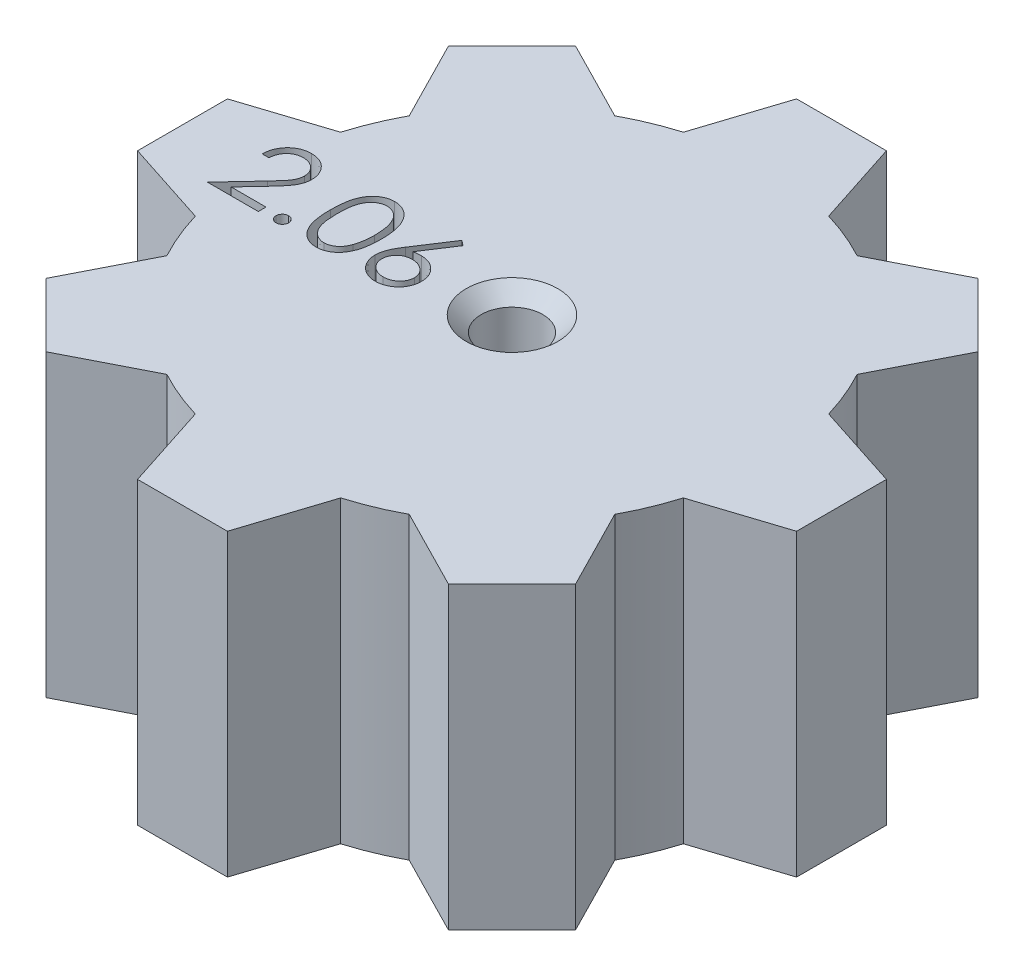
from build123d import *

# Parameters (mm, degrees)
SKETCH1_R           = 1.03
BOSS_EXTRUDE1_DEPTH = 10
CUT_EXTRUDE1_DEPTH  = 1
CHAMFER1_SIZE       = 0.5


with BuildPart() as part:
    # Sketch1 → Boss-Extrude1 (new body)
    with BuildSketch(Plane(origin=(0, 0, 0), x_dir=(1, 0, 0), z_dir=(0, 1, 0))):
        with BuildLine():
            Line((-1.5, 11), (1.5, 11))
            Line((1.5, 11), (2.425924848, 8.146464793))
            ThreePointArc((2.425924848, 8.146464793), (3.252809175, 7.852976026), (4.045032587, 7.475808409))
            Line((4.045032587, 7.475808409), (6.717514421, 8.838834765))
            Line((6.717514421, 8.838834765), (8.838834765, 6.717514421))
            Line((8.838834765, 6.717514421), (7.475808409, 4.045032587))
            ThreePointArc((7.475808409, 4.045032587), (7.852976026, 3.252809175), (8.146464793, 2.425924848))
            Line((8.146464793, 2.425924848), (11, 1.5))
            Line((11, 1.5), (11, -1.5))
            Line((11, -1.5), (8.146464793, -2.425924848))
            ThreePointArc((8.146464793, -2.425924848), (7.852976026, -3.252809175), (7.475808409, -4.045032587))
            Line((7.475808409, -4.045032587), (8.838834765, -6.717514421))
            Line((8.838834765, -6.717514421), (6.717514421, -8.838834765))
            Line((6.717514421, -8.838834765), (4.045032587, -7.475808409))
            ThreePointArc((4.045032587, -7.475808409), (3.252809175, -7.852976026), (2.425924848, -8.146464793))
            Line((2.425924848, -8.146464793), (1.5, -11))
            Line((1.5, -11), (-1.5, -11))
            Line((-1.5, -11), (-2.425924848, -8.146464793))
            ThreePointArc((-2.425924848, -8.146464793), (-3.252809175, -7.852976026), (-4.045032587, -7.475808409))
            Line((-4.045032587, -7.475808409), (-6.717514421, -8.838834765))
            Line((-6.717514421, -8.838834765), (-8.838834765, -6.717514421))
            Line((-8.838834765, -6.717514421), (-7.475808409, -4.045032587))
            ThreePointArc((-7.475808409, -4.045032587), (-7.852976026, -3.252809175), (-8.146464793, -2.425924848))
            Line((-8.146464793, -2.425924848), (-11, -1.5))
            Line((-11, -1.5), (-11, 1.5))
            Line((-11, 1.5), (-8.146464793, 2.425924848))
            ThreePointArc((-8.146464793, 2.425924848), (-7.852976026, 3.252809175), (-7.475808409, 4.045032587))
            Line((-7.475808409, 4.045032587), (-8.838834765, 6.717514421))
            Line((-8.838834765, 6.717514421), (-6.717514421, 8.838834765))
            Line((-6.717514421, 8.838834765), (-4.045032587, 7.475808409))
            ThreePointArc((-4.045032587, 7.475808409), (-3.252809175, 7.852976026), (-2.425924848, 8.146464793))
            Line((-2.425924848, 8.146464793), (-1.5, 11))
        make_face()
        with Locations(Location((0, 0, 0), (0, 0, 270))):
            Circle(SKETCH1_R, mode=Mode.SUBTRACT)
    extrude(amount=BOSS_EXTRUDE1_DEPTH)

    # Sketch2 → Cut-Extrude1 (cut)
    # profile 1 of 4: a face of its own
    with BuildSketch(Plane(origin=(0, 10, 0), x_dir=(1, 0, 0), z_dir=(0, 1, 0))):
        with BuildLine():
            Line((-8.605784239, 0.48976021), (-8.830143214, 0.48976021))
            add(Edge.make_bspline(
                [(-8.830143214, 0.48976021), (-8.828680962, 0.51952513), (-8.825809137, 0.57798264), (-8.812360359, 0.663214002), (-8.793116876, 0.744681715), (-8.765908694, 0.821731654), (-8.732118496, 0.895045087), (-8.691597048, 0.964330813), (-8.64360144, 1.029324519), (-8.589168059, 1.089423693), (-8.530047602, 1.144557672), (-8.466257645, 1.19216856), (-8.399225483, 1.232395468), (-8.329154484, 1.266024926), (-8.255254081, 1.291267673), (-8.178194897, 1.309997416), (-8.097638371, 1.321266234), (-8.042752641, 1.32247751), (-8.014838727, 1.323093543)],
                knots=[0, 0, 0, 0, 1.10065271, 2.161652631, 3.183658789, 4.190468796, 5.17591951, 6.163126047, 7.15150782, 8.156236427, 9.156009102, 10.134482811, 11.092018607, 12.041330605, 13.001268258, 13.972401359, 14.968799086, 16, 16, 16, 16], degree=3))
            add(Edge.make_bspline(
                [(-8.014838727, 1.323093543), (-7.987425817, 1.322451789), (-7.933560428, 1.321190764), (-7.854944703, 1.310361457), (-7.780103778, 1.29340032), (-7.709183945, 1.269603594), (-7.642751042, 1.237614718), (-7.58030601, 1.199187904), (-7.521105431, 1.154745167), (-7.467814871, 1.102421015), (-7.418880529, 1.046562169), (-7.376664632, 0.986927952), (-7.340512373, 0.925335605), (-7.310378316, 0.861315461), (-7.288195359, 0.794264727), (-7.271353782, 0.725159582), (-7.261834201, 0.653284717), (-7.260373184, 0.604637177), (-7.259630393, 0.579904441)],
                knots=[0, 0, 0, 0, 1.111607364, 2.184268762, 3.212621178, 4.221274766, 5.211760367, 6.196651075, 7.1921475, 8.207485113, 9.220403448, 10.201281604, 11.166441695, 12.114753415, 13.065576456, 14.026450734, 14.996634279, 16, 16, 16, 16], degree=3))
            add(Edge.make_bspline(
                [(-7.259630393, 0.579904441), (-7.260839867, 0.545084559), (-7.263237589, 0.476055835), (-7.283747858, 0.374616647), (-7.31578108, 0.276335633), (-7.354350621, 0.19723756), (-7.39325951, 0.133499351), (-7.428322015, 0.081021704), (-7.469368309, 0.024517798), (-7.516995807, -0.035823157), (-7.570219287, -0.100473804), (-7.629520833, -0.169395086), (-7.69532332, -0.241874922), (-7.741507963, -0.291378923), (-7.765439688, -0.317030656)],
                knots=[0, 0, 0, 0, 1.184426356, 2.348067706, 3.509069118, 4.696110526, 5.333549288, 6.050745305, 6.844228056, 7.710549037, 8.667450064, 9.695053472, 10.805634456, 12, 12, 12, 12], degree=3))
            Line((-7.765439688, -0.317030656), (-8.390940489, -0.984598765))
            Line((-8.390940489, -0.984598765), (-7.227579111, -0.984598765))
            Line((-7.227579111, -0.984598765), (-7.227579111, -1.241009021))
            Line((-7.227579111, -1.241009021), (-8.92629706, -1.241009021))
            Line((-8.92629706, -1.241009021), (-7.956745778, -0.206353572))
            add(Edge.make_bspline(
                [(-7.956745778, -0.206353572), (-7.933140145, -0.181711925), (-7.887798554, -0.134380363), (-7.823668142, -0.065278248), (-7.766068864, -0.001171434), (-7.714627869, 0.057818958), (-7.67046108, 0.112555792), (-7.631266629, 0.161266295), (-7.599862635, 0.206090902), (-7.56578021, 0.258048484), (-7.532770223, 0.321485853), (-7.504404254, 0.399009917), (-7.487107934, 0.478815097), (-7.485033051, 0.532745124), (-7.483989368, 0.559872389)],
                knots=[0, 0, 0, 0, 1.329631726, 2.553950428, 3.673215718, 4.687767853, 5.603093632, 6.413772471, 7.123043292, 7.734684054, 8.834405432, 9.900288307, 10.943827018, 12, 12, 12, 12], degree=3))
            add(Edge.make_bspline(
                [(-7.483989368, 0.559872389), (-7.484443469, 0.576930531), (-7.485338416, 0.610548853), (-7.493236772, 0.659838681), (-7.505172848, 0.707384976), (-7.522276603, 0.75333399), (-7.544852846, 0.797223741), (-7.572333832, 0.839107656), (-7.60404102, 0.879599774), (-7.640720498, 0.917566415), (-7.681014441, 0.952338705), (-7.723581762, 0.983141623), (-7.768617551, 1.008883845), (-7.815931924, 1.029986343), (-7.865392973, 1.046540187), (-7.917096363, 1.058010601), (-7.970899231, 1.065212375), (-8.007637443, 1.066186783), (-8.026357156, 1.066683287)],
                knots=[0, 0, 0, 0, 0.991446411, 1.95395049, 2.89581595, 3.838931463, 4.798493298, 5.75982156, 6.748411868, 7.785213223, 8.824556874, 9.840280684, 10.836137867, 11.835679398, 12.848801643, 13.863922112, 14.911575587, 16, 16, 16, 16], degree=3))
            add(Edge.make_bspline(
                [(-8.026357156, 1.066683287), (-8.045907751, 1.066172549), (-8.084301891, 1.065169546), (-8.140672629, 1.058153357), (-8.194448184, 1.046049185), (-8.245763829, 1.029494418), (-8.294706391, 1.008452597), (-8.341037851, 0.982244208), (-8.3846542, 0.950970285), (-8.425637431, 0.915512744), (-8.463397416, 0.876035886), (-8.496573756, 0.83202877), (-8.525562338, 0.784294902), (-8.550854647, 0.73296308), (-8.571394426, 0.677567523), (-8.587089533, 0.618304876), (-8.599508709, 0.555432461), (-8.603657653, 0.512014543), (-8.605784239, 0.48976021)],
                knots=[0, 0, 0, 0, 1.031018746, 2.02475058, 2.990194455, 3.934040569, 4.864654155, 5.795059489, 6.735614925, 7.690564532, 8.649604399, 9.611025574, 10.590972636, 11.591080095, 12.624614302, 13.701020113, 14.821632451, 16, 16, 16, 16], degree=3))
        make_face()
    # profile 2 of 4: a face of its own
    with BuildSketch(Plane(origin=(0, 10, 0), x_dir=(1, 0, 0), z_dir=(0, 1, 0))):
        with BuildLine():
            add(Edge.make_bspline(
                [(-6.602579111, -0.856393636), (-6.588657531, -0.857220898), (-6.561365901, -0.858842649), (-6.521909381, -0.869968844), (-6.486198909, -0.88972503), (-6.454390163, -0.916055586), (-6.428171251, -0.94798106), (-6.407711, -0.983406709), (-6.396681725, -1.023193561), (-6.395071788, -1.050643329), (-6.394245778, -1.06472697)],
                knots=[0, 0, 0, 0, 1.020151414, 1.999887582, 2.974338812, 3.990962822, 5.007586832, 5.987933904, 6.967670073, 8, 8, 8, 8], degree=3))
            add(Edge.make_bspline(
                [(-6.394245778, -1.06472697), (-6.395099778, -1.078472205), (-6.396783855, -1.105577608), (-6.407685718, -1.145064367), (-6.428327182, -1.180512156), (-6.45420932, -1.212870826), (-6.486206773, -1.239257162), (-6.521993806, -1.258845265), (-6.561273276, -1.270768108), (-6.588642078, -1.272286892), (-6.602579111, -1.273060303)],
                knots=[0, 0, 0, 0, 1.009421747, 1.99056486, 2.972319754, 3.999869655, 5.017953583, 5.993804169, 6.978383603, 8, 8, 8, 8], degree=3))
            add(Edge.make_bspline(
                [(-6.602579111, -1.273060303), (-6.616526187, -1.272314876), (-6.643754531, -1.270859609), (-6.682887384, -1.258600461), (-6.718892362, -1.239440847), (-6.750883585, -1.212821626), (-6.776982493, -1.180678666), (-6.796714909, -1.14482024), (-6.808565016, -1.105690642), (-6.810123496, -1.078494469), (-6.810912445, -1.06472697)],
                knots=[0, 0, 0, 0, 1.022052826, 1.995314843, 2.982371812, 4.00089066, 5.028879526, 6.005146991, 6.990147033, 8, 8, 8, 8], degree=3))
            add(Edge.make_bspline(
                [(-6.810912445, -1.06472697), (-6.810153802, -1.05062027), (-6.808672646, -1.02307867), (-6.796690032, -0.983650736), (-6.777135595, -0.947816137), (-6.75070317, -0.916104294), (-6.718900101, -0.889541935), (-6.68297424, -0.870209939), (-6.643660283, -0.858752502), (-6.616510327, -0.857193562), (-6.602579111, -0.856393636)],
                knots=[0, 0, 0, 0, 1.032775665, 2.016367738, 2.991239715, 4.008302682, 5.025365648, 6.011011707, 6.979408107, 8, 8, 8, 8], degree=3))
        make_face()
    # profile 3 of 4: a face of its own
    with BuildSketch(Plane(origin=(0, 10, 0), x_dir=(1, 0, 0), z_dir=(0, 1, 0))):
        with BuildLine():
            add(Edge.make_bspline(
                [(-6.073732957, 0.007989376), (-6.073498659, 0.048058939), (-6.07304353, 0.125894642), (-6.067980372, 0.239312244), (-6.059569414, 0.34571245), (-6.048042719, 0.445100354), (-6.03401559, 0.537501615), (-6.015290242, 0.622669298), (-5.993995383, 0.700997589), (-5.969315065, 0.772741909), (-5.941466644, 0.83886884), (-5.911156458, 0.900601127), (-5.877181605, 0.957845364), (-5.84148381, 1.011515214), (-5.802618044, 1.060732139), (-5.761690337, 1.106191184), (-5.717103282, 1.14684172), (-5.670372562, 1.183874793), (-5.621075088, 1.216338701), (-5.57061604, 1.244933515), (-5.518648108, 1.269361991), (-5.465029406, 1.288569445), (-5.410241864, 1.304434336), (-5.354093959, 1.315283584), (-5.296492985, 1.322109947), (-5.257613389, 1.322762567), (-5.237895618, 1.323093543)],
                knots=[0, 0, 0, 0, 1.646270934, 3.197905019, 4.663502075, 6.030701355, 7.308322542, 8.50163776, 9.611534131, 10.641858119, 11.616356847, 12.558055219, 13.465016945, 14.349605745, 15.204443733, 16.039544428, 16.859896111, 17.680448484, 18.487036065, 19.28249412, 20.06191084, 20.843045899, 21.620316918, 22.403196591, 23.190181807, 24, 24, 24, 24], degree=3))
            add(Edge.make_bspline(
                [(-5.237895618, 1.323093543), (-5.218013133, 1.322745104), (-5.178473127, 1.322052167), (-5.120015716, 1.315392208), (-5.0629088, 1.304341406), (-5.007395844, 1.288683567), (-4.953020854, 1.269258084), (-4.900209134, 1.244910143), (-4.848632647, 1.216568095), (-4.799111013, 1.183265325), (-4.751100574, 1.146135128), (-4.7057806, 1.104161793), (-4.663146967, 1.057769137), (-4.622664606, 1.00745352), (-4.585482037, 0.952249888), (-4.550072442, 0.893118381), (-4.518378131, 0.829024906), (-4.487853363, 0.761038857), (-4.461505515, 0.687279101), (-4.437743912, 0.608161415), (-4.418544648, 0.522751281), (-4.402552311, 0.431496821), (-4.3901631, 0.334062904), (-4.381139784, 0.230658393), (-4.376373295, 0.121215257), (-4.375475651, 0.046388222), (-4.375015009, 0.007989376)],
                knots=[0, 0, 0, 0, 0.810914788, 1.612654377, 2.396697861, 3.181598691, 3.963628158, 4.749916497, 5.551656086, 6.361998678, 7.18212741, 8.025565596, 8.878627764, 9.750805457, 10.657531673, 11.591944965, 12.560506719, 13.57287815, 14.630710178, 15.753379473, 16.941251878, 18.199788006, 19.531962791, 20.947069417, 22.433333509, 24, 24, 24, 24], degree=3))
            add(Edge.make_bspline(
                [(-4.375015009, 0.007989376), (-4.375480426, -0.030241986), (-4.376387273, -0.104734238), (-4.38108635, -0.213684934), (-4.390342515, -0.31654068), (-4.401921078, -0.413548153), (-4.41795748, -0.504303595), (-4.437675456, -0.589121058), (-4.459568544, -0.668366823), (-4.486593396, -0.741391689), (-4.516172475, -0.809214348), (-4.548354758, -0.872548025), (-4.582833205, -0.93195252), (-4.620396595, -0.986952339), (-4.660434747, -1.037937094), (-4.703804596, -1.084006825), (-4.749283586, -1.126271591), (-4.797435311, -1.163879896), (-4.847729276, -1.196797614), (-4.899128617, -1.226236078), (-4.952545319, -1.249973717), (-5.006768857, -1.27035589), (-5.062574833, -1.285927641), (-5.119893683, -1.296694681), (-5.178433852, -1.304246001), (-5.218006398, -1.304822058), (-5.237895618, -1.305111585)],
                knots=[0, 0, 0, 0, 1.561518951, 3.042555995, 4.452378317, 5.7783523, 7.031515105, 8.214008947, 9.334062868, 10.386615937, 11.391082383, 12.354592575, 13.286541444, 14.194233754, 15.072674879, 15.931287219, 16.775624067, 17.606195743, 18.42308326, 19.229000347, 20.022332153, 20.807536673, 21.593273796, 22.3848459, 23.188221202, 24, 24, 24, 24], degree=3))
            add(Edge.make_bspline(
                [(-5.237895618, -1.305111585), (-5.257612842, -1.304778474), (-5.29649136, -1.304121644), (-5.354100235, -1.297326122), (-5.410016266, -1.286400762), (-5.464515376, -1.271103188), (-5.517877173, -1.252378305), (-5.56937452, -1.227982816), (-5.619580008, -1.199887053), (-5.668359691, -1.167890323), (-5.714796949, -1.131231978), (-5.759153096, -1.090686058), (-5.800313824, -1.045240764), (-5.838623892, -0.995613676), (-5.875033955, -0.94226136), (-5.908526365, -0.884455379), (-5.939505546, -0.822424943), (-5.967822325, -0.755769293), (-5.992928513, -0.683515773), (-6.015105448, -0.604837788), (-6.03261556, -0.519040905), (-6.047603385, -0.426814214), (-6.05969223, -0.327761407), (-6.06794532, -0.221828708), (-6.073046259, -0.109082131), (-6.073499881, -0.031746577), (-6.073732957, 0.007989376)],
                knots=[0, 0, 0, 0, 0.810891512, 1.598919785, 2.382837074, 3.152667961, 3.926044502, 4.706494248, 5.493654104, 6.291793342, 7.103789334, 7.925228297, 8.761435821, 9.622817696, 10.50288917, 11.416980706, 12.369136599, 13.353924996, 14.394355917, 15.514179734, 16.714354668, 17.994756427, 19.357759367, 20.818452758, 22.365282078, 24, 24, 24, 24], degree=3))
        make_face()
        with BuildLine():
            add(Edge.make_bspline(
                [(-5.849373983, 0.008990979), (-5.849288664, -0.024400949), (-5.849123076, -0.089208124), (-5.844797218, -0.183381881), (-5.838904195, -0.271217831), (-5.831303269, -0.352827499), (-5.820015448, -0.427934651), (-5.807367743, -0.497055853), (-5.79197625, -0.559825309), (-5.773765523, -0.616673745), (-5.753023311, -0.668565937), (-5.730376266, -0.716852519), (-5.706047178, -0.762103902), (-5.678819213, -0.803913622), (-5.649165596, -0.842418025), (-5.617756126, -0.87829862), (-5.583418565, -0.910296463), (-5.535915892, -0.948672788), (-5.473204125, -0.988329313), (-5.394189514, -1.022862234), (-5.312997763, -1.044563988), (-5.257889727, -1.047323814), (-5.230383598, -1.048701329)],
                knots=[0, 0, 0, 0, 1.459021318, 2.831673884, 4.118529203, 5.306027144, 6.411944654, 7.436330062, 8.375795394, 9.233974572, 10.042671642, 10.816086306, 11.563610507, 12.285937304, 12.993564865, 13.685989202, 14.367179055, 15.041617293, 16.353048772, 17.594441528, 18.799311195, 20, 20, 20, 20], degree=3))
            add(Edge.make_bspline(
                [(-5.230383598, -1.048701329), (-5.202699547, -1.047560057), (-5.147388602, -1.045279869), (-5.066578748, -1.023280771), (-4.988128556, -0.990088243), (-4.926648598, -0.950840024), (-4.879875353, -0.913462646), (-4.846363217, -0.88159504), (-4.815604611, -0.845912278), (-4.7864317, -0.807412781), (-4.759675218, -0.765361007), (-4.735344405, -0.719959167), (-4.713142014, -0.671081183), (-4.700492696, -0.636959941), (-4.694025425, -0.61951463)],
                knots=[0, 0, 0, 0, 1.353760809, 2.704726607, 4.075137775, 5.516104923, 6.260822281, 7.007110065, 7.778089737, 8.566572457, 9.372053459, 10.217411131, 11.088608312, 12, 12, 12, 12], degree=3))
            add(Edge.make_bspline(
                [(-4.694025425, -0.61951463), (-4.686488448, -0.597207673), (-4.671185153, -0.551914984), (-4.651462457, -0.481655233), (-4.635930029, -0.407938973), (-4.621956196, -0.331206747), (-4.612418299, -0.250892675), (-4.60474129, -0.167245258), (-4.60021937, -0.080201427), (-4.599658834, -0.021062148), (-4.599373983, 0.008990979)],
                knots=[0, 0, 0, 0, 0.884706709, 1.796334032, 2.740027952, 3.714592787, 4.726048262, 5.777819803, 6.87074269, 8, 8, 8, 8], degree=3))
            add(Edge.make_bspline(
                [(-4.599373983, 0.008990979), (-4.599766975, 0.039039245), (-4.600535752, 0.097820077), (-4.603474315, 0.183904492), (-4.611062582, 0.265667178), (-4.619490525, 0.343460373), (-4.631917111, 0.416853446), (-4.645315545, 0.486460807), (-4.66331641, 0.551420111), (-4.682544821, 0.612748383), (-4.704552247, 0.669748851), (-4.728777771, 0.72268727), (-4.754650456, 0.771819216), (-4.782752056, 0.817009888), (-4.812748973, 0.858461705), (-4.845432936, 0.895343558), (-4.879507488, 0.928798535), (-4.92723405, 0.966986085), (-4.989715685, 1.00592301), (-5.067462576, 1.041755696), (-5.148370179, 1.062333048), (-5.203065504, 1.065234253), (-5.230383598, 1.066683287)],
                knots=[0, 0, 0, 0, 1.31362396, 2.569729283, 3.763502607, 4.902122613, 5.988968491, 7.01645872, 7.998833611, 8.933434873, 9.825090667, 10.667526885, 11.477055099, 12.250526234, 12.991942729, 13.710640831, 14.402115721, 15.076753259, 16.378508321, 17.609869233, 18.806226677, 20, 20, 20, 20], degree=3))
            add(Edge.make_bspline(
                [(-5.230383598, 1.066683287), (-5.258034021, 1.065232253), (-5.31338524, 1.062327543), (-5.395133779, 1.041832362), (-5.47349403, 1.006108815), (-5.53581044, 0.96685712), (-5.583570288, 0.929472612), (-5.617200783, 0.897053717), (-5.648733763, 0.861592106), (-5.677782121, 0.822733596), (-5.704988751, 0.780972619), (-5.729975189, 0.735980644), (-5.752487567, 0.68752967), (-5.773262236, 0.635660787), (-5.791528513, 0.578817256), (-5.80659563, 0.516125117), (-5.820514953, 0.447223766), (-5.830368717, 0.371709832), (-5.839128542, 0.290079722), (-5.844758077, 0.202024495), (-5.849137546, 0.107692795), (-5.849293592, 0.042550539), (-5.849373983, 0.008990979)],
                knots=[0, 0, 0, 0, 1.207732386, 2.417664972, 3.655092373, 4.956220595, 5.625982001, 6.301752483, 6.994047911, 7.697131622, 8.419323945, 9.170223765, 9.943494443, 10.752040957, 11.610060368, 12.549350801, 13.567764191, 14.679664412, 15.874934091, 17.154273443, 18.533957287, 20, 20, 20, 20], degree=3))
        make_face(mode=Mode.SUBTRACT)
    # profile 4 of 4: a face of its own
    with BuildSketch(Plane(origin=(0, 10, 0), x_dir=(1, 0, 0), z_dir=(0, 1, 0))):
        with BuildLine():
            Line((-2.996809881, 1.323093543), (-2.824033438, 1.187376396))
            Line((-2.824033438, 1.187376396), (-3.484590329, 0.17726021))
            add(Edge.make_bspline(
                [(-3.484590329, 0.17726021), (-3.44061156, 0.18427011), (-3.354825998, 0.197943714), (-3.267993213, 0.200199389), (-3.225676066, 0.201298671)],
                knots=[0, 0, 0, 0, 1.025318673, 2, 2, 2, 2], degree=3))
            add(Edge.make_bspline(
                [(-3.225676066, 0.201298671), (-3.20026714, 0.200615734), (-3.150250426, 0.199271393), (-3.076816996, 0.188925786), (-3.00625347, 0.172622134), (-2.938852318, 0.148856237), (-2.874371617, 0.118497413), (-2.812441334, 0.082112505), (-2.754225613, 0.037822734), (-2.69897477, -0.011652235), (-2.648812558, -0.066450081), (-2.60440109, -0.124593893), (-2.567096238, -0.186023093), (-2.536829152, -0.250706569), (-2.513325667, -0.318544612), (-2.496191635, -0.389450426), (-2.486063354, -0.463472905), (-2.484688004, -0.513814459), (-2.483989368, -0.539386425)],
                knots=[0, 0, 0, 0, 1.04369286, 2.054478336, 3.041073146, 4.015093852, 4.984733326, 5.965804835, 6.960378782, 7.985147595, 9.009457201, 10.008161701, 10.986880575, 11.956520048, 12.937015923, 13.931873656, 14.949455224, 16, 16, 16, 16], degree=3))
            add(Edge.make_bspline(
                [(-2.483989368, -0.539386425), (-2.485005871, -0.574371928), (-2.487006109, -0.643215118), (-2.506937392, -0.743484194), (-2.537908567, -0.839007419), (-2.58217823, -0.928259684), (-2.637165647, -1.011118663), (-2.70422107, -1.084536852), (-2.780966419, -1.15001545), (-2.867742703, -1.204770178), (-2.961130535, -1.249486643), (-3.059239104, -1.281604673), (-3.161115637, -1.30137858), (-3.230261786, -1.303857582), (-3.265239368, -1.305111585)],
                knots=[0, 0, 0, 0, 1.031375318, 2.029502543, 3.004789286, 3.987476834, 4.960371455, 5.9300674, 6.912260825, 7.929083631, 8.949397511, 9.960523116, 10.96833055, 12, 12, 12, 12], degree=3))
            add(Edge.make_bspline(
                [(-3.265239368, -1.305111585), (-3.298879868, -1.30402001), (-3.36551581, -1.30185779), (-3.463539234, -1.282596405), (-3.557727104, -1.251377046), (-3.647419518, -1.208366847), (-3.730505671, -1.154039788), (-3.804838268, -1.08863816), (-3.870046678, -1.013559971), (-3.924314265, -0.928816866), (-3.967356216, -0.83775261), (-3.999634734, -0.742797498), (-4.018489194, -0.644297512), (-4.021123877, -0.577525269), (-4.022450906, -0.543893636)],
                knots=[0, 0, 0, 0, 1.012016664, 2.004627821, 2.994792927, 3.992885782, 4.990978636, 5.973936114, 6.964471063, 7.975201453, 8.993600317, 9.990122807, 10.98767138, 12, 12, 12, 12], degree=3))
            add(Edge.make_bspline(
                [(-4.022450906, -0.543893636), (-4.021607017, -0.518147505), (-4.019883956, -0.465578825), (-4.007852963, -0.385961663), (-3.988520967, -0.304496604), (-3.966870791, -0.235386466), (-3.943995355, -0.178771093), (-3.924957827, -0.133125743), (-3.901262115, -0.086153548), (-3.875995414, -0.036243808), (-3.846883365, 0.015317216), (-3.81522933, 0.069391265), (-3.780158151, 0.125118357), (-3.75557232, 0.162935639), (-3.743003791, 0.182268223)],
                knots=[0, 0, 0, 0, 1.173818275, 2.396712641, 3.66331629, 4.989737886, 5.693666774, 6.447286557, 7.243889047, 8.091586357, 8.998013824, 9.943181721, 10.948533338, 12, 12, 12, 12], degree=3))
            Line((-3.743003791, 0.182268223), (-2.996809881, 1.323093543))
        make_face()
        with BuildLine():
            add(Edge.make_bspline(
                [(-3.272751387, -0.055111585), (-3.291795848, -0.055667331), (-3.328995211, -0.056752863), (-3.383571936, -0.063056614), (-3.435224259, -0.074927375), (-3.484636497, -0.090046184), (-3.530884856, -0.110834084), (-3.574305456, -0.136085369), (-3.615066207, -0.165814782), (-3.652740173, -0.199601147), (-3.686897075, -0.236592599), (-3.716312169, -0.276213686), (-3.741685312, -0.317509546), (-3.762315182, -0.360825219), (-3.778379522, -0.406144147), (-3.789999701, -0.453257896), (-3.796466666, -0.502482401), (-3.797542546, -0.53586276), (-3.798091932, -0.552908059)],
                knots=[0, 0, 0, 0, 1.129588631, 2.206414736, 3.251139165, 4.268635594, 5.265702196, 6.250456724, 7.242448911, 8.251968645, 9.246821453, 10.222880186, 11.173611482, 12.116736599, 13.062300278, 14.020270554, 14.989073742, 16, 16, 16, 16], degree=3))
            add(Edge.make_bspline(
                [(-3.798091932, -0.552908059), (-3.797644531, -0.569800902), (-3.796767244, -0.602925252), (-3.788801301, -0.651738952), (-3.776633385, -0.698713886), (-3.758533102, -0.743607885), (-3.736942468, -0.787105255), (-3.708438665, -0.827630459), (-3.676855247, -0.867644795), (-3.639102437, -0.904074418), (-3.598585749, -0.937972006), (-3.555299176, -0.967600759), (-3.510184919, -0.992948026), (-3.462633903, -1.012813095), (-3.413320772, -1.029116157), (-3.361834662, -1.040588642), (-3.308139765, -1.047074732), (-3.271766952, -1.048152014), (-3.253220137, -1.048701329)],
                knots=[0, 0, 0, 0, 0.989467248, 1.94019797, 2.891935182, 3.827694429, 4.772920941, 5.730924762, 6.725747692, 7.756678648, 8.79901574, 9.819492441, 10.826891316, 11.826466727, 12.835195252, 13.867842842, 14.912794438, 16, 16, 16, 16], degree=3))
            add(Edge.make_bspline(
                [(-3.253220137, -1.048701329), (-3.234673352, -1.048151971), (-3.198300599, -1.047074605), (-3.14460527, -1.040589127), (-3.093120757, -1.029114379), (-3.043801822, -1.012819543), (-2.996272229, -0.992924107), (-2.951197428, -0.96775845), (-2.908320218, -0.937789795), (-2.867776932, -0.904132346), (-2.830181262, -0.867437452), (-2.797840349, -0.82798765), (-2.770209468, -0.786777725), (-2.747756477, -0.743779232), (-2.729855555, -0.698686741), (-2.717625935, -0.651746224), (-2.709676443, -0.602923348), (-2.708796896, -0.569800259), (-2.708348342, -0.552908059)],
                knots=[0, 0, 0, 0, 1.087397944, 2.132534446, 3.165364764, 4.174271784, 5.174024072, 6.181601208, 7.194203697, 8.236725232, 9.267838612, 10.269026844, 11.221737037, 12.171628256, 13.107553087, 14.05945871, 15.010357665, 16, 16, 16, 16], degree=3))
            add(Edge.make_bspline(
                [(-2.708348342, -0.552908059), (-2.708741408, -0.535840523), (-2.70951287, -0.5023425), (-2.718238548, -0.453279915), (-2.730340243, -0.405904768), (-2.748613837, -0.360514804), (-2.772354226, -0.317289142), (-2.801270945, -0.276009427), (-2.834722781, -0.236359179), (-2.873363881, -0.199528602), (-2.915428333, -0.165852118), (-2.960153752, -0.136123863), (-3.006945161, -0.111034594), (-3.05575512, -0.090100949), (-3.107142894, -0.074994182), (-3.16027885, -0.063099009), (-3.215842595, -0.056768996), (-3.253540172, -0.055671092), (-3.272751387, -0.055111585)],
                knots=[0, 0, 0, 0, 0.978206639, 1.919901502, 2.851605144, 3.780102724, 4.718870031, 5.675451981, 6.667674623, 7.690630536, 8.733308323, 9.756129687, 10.767539656, 11.776269907, 12.797430371, 13.836405707, 14.897401972, 16, 16, 16, 16], degree=3))
        make_face(mode=Mode.SUBTRACT)
    extrude(amount=-CUT_EXTRUDE1_DEPTH, mode=Mode.SUBTRACT)

    # Chamfer1
    chamfer1_edges = [part.edges().sort_by_distance(p)[0] for p in [
        (0, 10, -1.03),
    ]]
    chamfer(chamfer1_edges, length=CHAMFER1_SIZE)


solid = part.part
